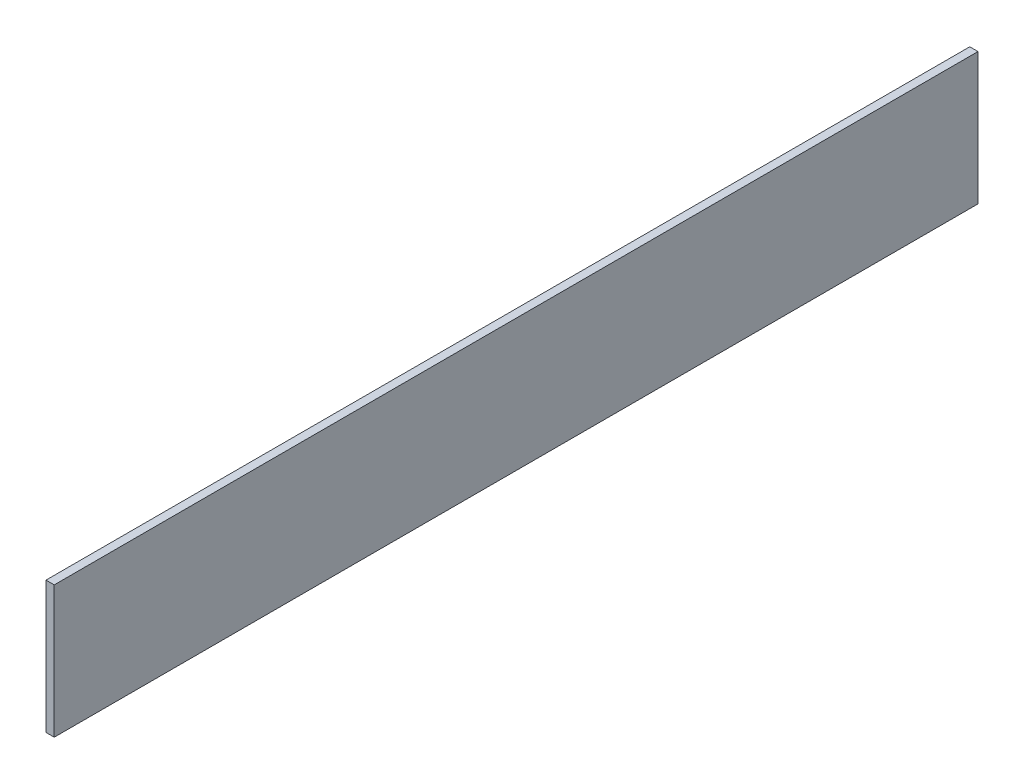
from build123d import *

# Parameters (mm, degrees)
SKETCH1_W           = 533.4
SKETCH1_H           = 76.2
BOSS_EXTRUDE1_DEPTH = 4.7625


with BuildPart() as part:
    # Sketch1 → Boss-Extrude1 (new body)
    with BuildSketch(Plane(origin=(0, 0, 0), x_dir=(0, 0, -1), z_dir=(1, 0, 0))):
        with Locations((17.987210526, 149.524947401)):
            Rectangle(SKETCH1_W, SKETCH1_H)
    extrude(amount=BOSS_EXTRUDE1_DEPTH)


solid = part.part
